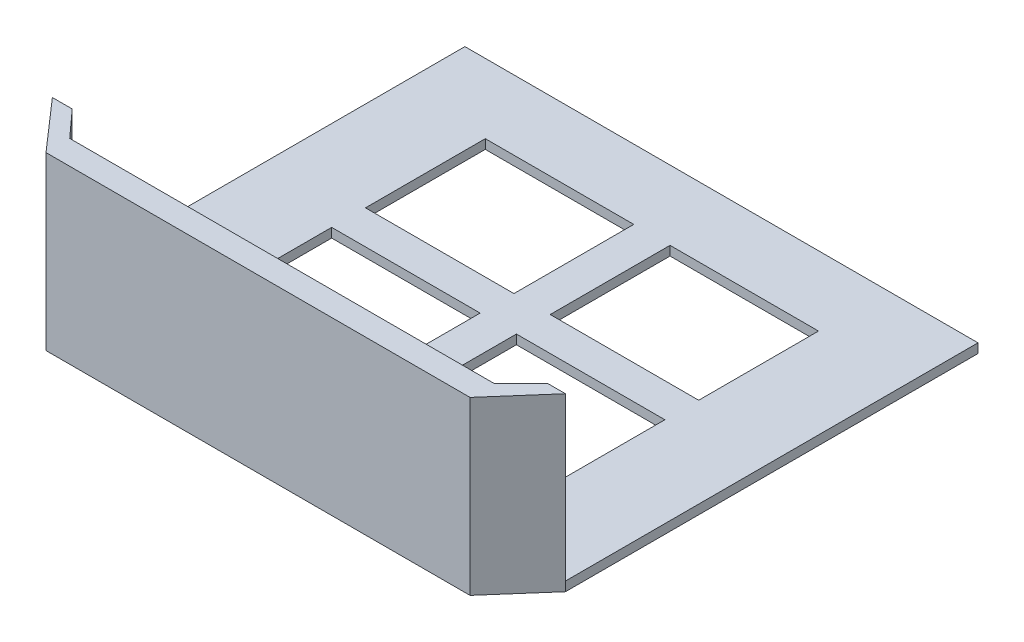
from build123d import *

# Parameters (mm, degrees)
BOSS_EXTRU_1_DEPTH           = 5.5
BOSS_EXTRU_2_DEPTH           = 96
ENL_V_MAT_EXTRU_1_DEPTH      = 39
ENL_V_MAT_EXTRU_1_DEPTH_BACK = 37
ESQUISSE3_W                  = 197.227924694
ESQUISSE3_H                  = 161.841973662
BOSS_EXTRU_3_DEPTH           = 5.5


with BuildPart() as part:
    # Esquisse1 → Boss.-Extru.1 (new body)
    with BuildSketch(Plane(origin=(0, 0, 0), x_dir=(-1, 0, 0), z_dir=(0, 1, 0))):
        Polygon((-151.846153846, 122.087912088), (-125.490601914, 152.208542868), (125.490601914, 152.208542868), (151.846153846, 122.087912088), (151.846153846, -122.087912088), (-151.846153846, -122.087912088), align=None)
    extrude(amount=BOSS_EXTRU_1_DEPTH)

    # Esquisse2 → Boss.-Extru.2 (add)
    with BuildSketch(Plane(origin=(0, 5.5, 0), x_dir=(1, 0, 0), z_dir=(0, 1, 0))):
        Polygon((-151.846153846, -122.087912088), (-140.09050176, -122.087912088), (-125.734949828, -137.938542868), (125.490601914, -137.938542868), (141.341232694, -122.087912088), (151.846153846, -122.087912088), (125.490601914, -152.208542868), (-125.490601914, -152.208542868), align=None)
    extrude(amount=BOSS_EXTRU_2_DEPTH)

    # Esquisse3 → Enlèv. mat.-Extru.1 (cut, two sides: drawn at the far end of the back side and taken through both)
    with BuildSketch(Plane.XZ.offset(-ENL_V_MAT_EXTRU_1_DEPTH_BACK)):
        Rectangle(ESQUISSE3_W, ESQUISSE3_H)
    extrude(amount=ENL_V_MAT_EXTRU_1_DEPTH + ENL_V_MAT_EXTRU_1_DEPTH_BACK, mode=Mode.SUBTRACT)

    # Esquisse4 → Boss.-Extru.3 (add)
    with BuildSketch(Plane.XZ):
        Polygon((-10.738571279, 80.920986831), (10.738571279, 80.920986831), (10.738571279, 10), (98.613962347, 10), (98.613962347, -10), (10.738571279, -10), (10.738571279, -80.920986831), (-10.738571279, -80.920986831), (-10.738571279, -10), (-98.613962347, -10), (-98.613962347, 10), (-10.738571279, 10), align=None)
    extrude(amount=-BOSS_EXTRU_3_DEPTH)


solid = part.part
